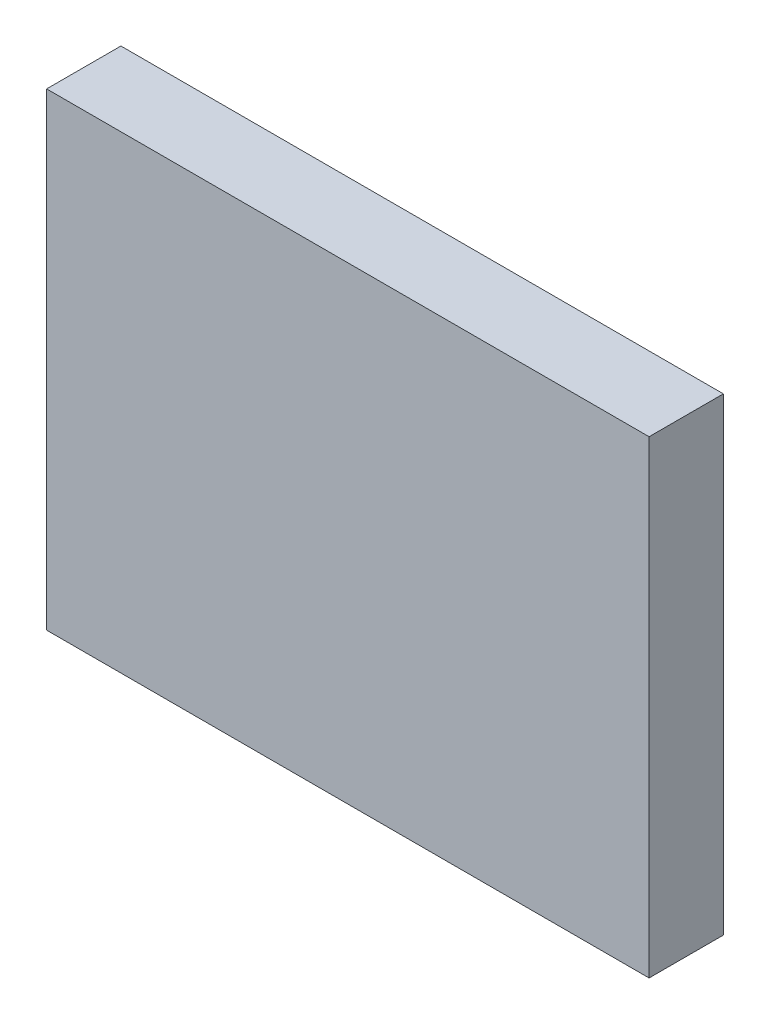
from build123d import *

# Parameters (mm, degrees)
SKETCH1_W               = 7.3
SKETCH1_H               = 5.68
COMPONENT_OUTLINE_DEPTH = 0.9


with BuildPart() as part:
    # Sketch1 → Component_Outline (new body)
    with BuildSketch(Plane.XY):
        with Locations((0, 0.04)):
            Rectangle(SKETCH1_W, SKETCH1_H)
    extrude(amount=COMPONENT_OUTLINE_DEPTH)


solid = part.part
